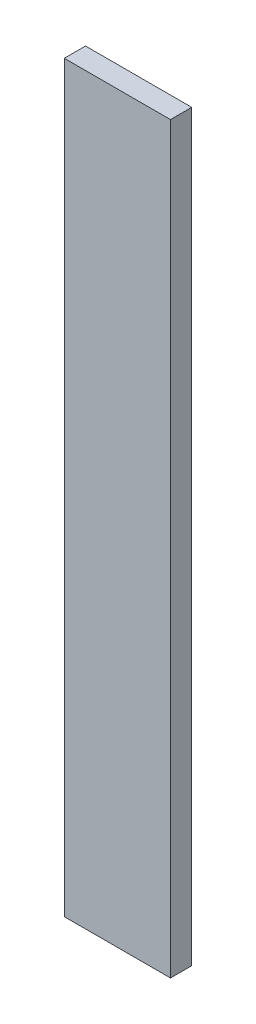
from build123d import *

# Parameters (mm, degrees)
SKETCH1_W           = 25.4
SKETCH1_H           = 5.08
BOSS_EXTRUDE1_DEPTH = 177.8


with BuildPart() as part:
    # Sketch1 → Boss-Extrude1 (new body)
    with BuildSketch(Plane(origin=(0, 0, 0), x_dir=(1, 0, 0), z_dir=(0, 1, 0))):
        Rectangle(SKETCH1_W, SKETCH1_H)
    extrude(amount=BOSS_EXTRUDE1_DEPTH)


solid = part.part
